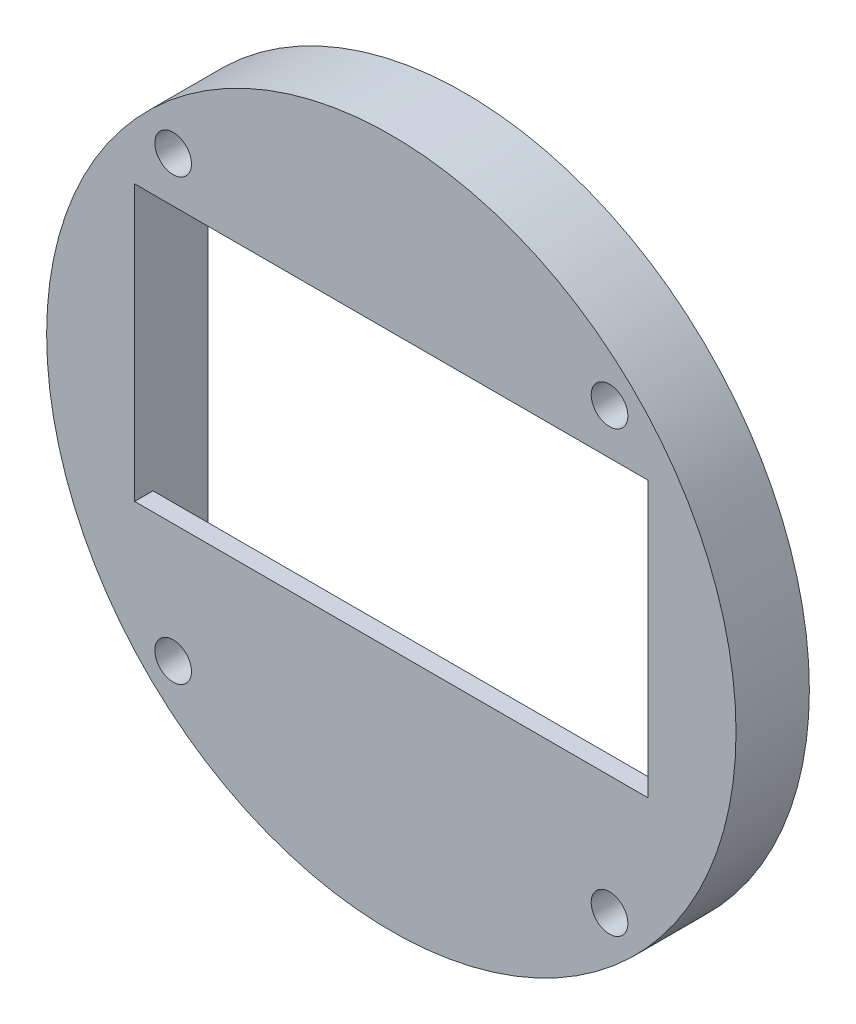
from build123d import *

# Parameters (mm, degrees)
SKETCH1_R           = 18.8
SKETCH1_R_2         = 1
SKETCH1_W           = 28
SKETCH1_H           = 15
BOSS_EXTRUDE1_DEPTH = 4
CUT_EXTRUDE1_DEPTH  = 3
FILLET1_R           = 1


with BuildPart() as part:
    # Sketch1 → Boss-Extrude1 (new body)
    with BuildSketch(Plane.XY):
        Circle(SKETCH1_R)
        with Locations((-11.9, 11.985611511)):
            Circle(SKETCH1_R_2, mode=Mode.SUBTRACT)
        with Locations((11.9, 11.985611511)):
            Circle(SKETCH1_R_2, mode=Mode.SUBTRACT)
        with Locations((11.9, -11.985611511)):
            Circle(SKETCH1_R_2, mode=Mode.SUBTRACT)
        with Locations((-11.9, -11.985611511)):
            Circle(SKETCH1_R_2, mode=Mode.SUBTRACT)
        with Locations((0, 2)):
            Rectangle(SKETCH1_W, SKETCH1_H, mode=Mode.SUBTRACT)
    extrude(amount=BOSS_EXTRUDE1_DEPTH)

    # Sketch2 → Cut-Extrude1 (cut)
    with BuildSketch(Plane(origin=(0, 0, 0), x_dir=(-1, 0, 0), z_dir=(0, 0, -1))):
        Polygon((-14, 9.8), (-7, 9.8), (-7, 13.8), (7, 13.8), (7, 9.8), (14, 9.8), (14, -10.1), (7, -10.1), (7, -14.1), (-7, -14.1), (-7, -10.1), (-14, -10.1), align=None)
    extrude(amount=-CUT_EXTRUDE1_DEPTH, mode=Mode.SUBTRACT)

    # Fillet1
    fillet1_edges = [part.edges().sort_by_distance(p)[0] for p in [
        (7, 13.8, 1.5),
        (-7, 13.8, 1.5),
        (-7, -14.1, 1.5),
        (7, -14.1, 1.5),
    ]]
    fillet(fillet1_edges, radius=FILLET1_R)


solid = part.part
